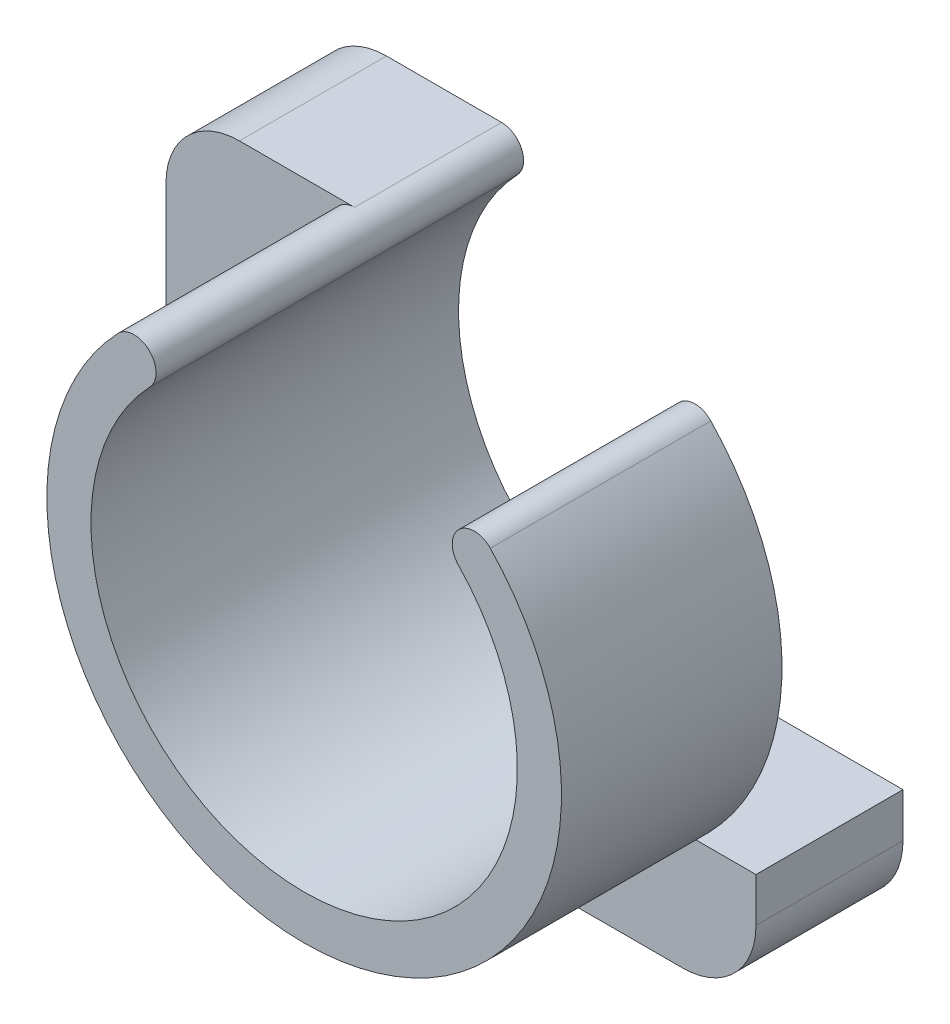
from build123d import *

# Parameters (mm, degrees)
BOSS_EXTRUDE1_START = 10
BOSS_EXTRUDE1_DEPTH = 15
BOSS_EXTRUDE3_DEPTH = 10
FILLET1_R           = 5
BOSS_EXTRUDE4_START = 10
BOSS_EXTRUDE4_DEPTH = 10


with BuildPart() as part:
    # Sketch1 → Boss-Extrude1 (new body)
    with BuildSketch(Plane.XY.offset(BOSS_EXTRUDE1_START)):
        with BuildLine():
            ThreePointArc((8.488266962, -3.382949128), (-2.000000007, -27.895254363), (-12.488266953, -3.382949118))
            ThreePointArc((-12.488266953, -3.382949118), (-12.537504406, -1.262200246), (-14.658253277, -1.311437749))
            ThreePointArc((-14.658253277, -1.311437749), (-1.999999957, -30.895254363), (10.658253217, -1.311437686))
            ThreePointArc((10.658253217, -1.311437686), (8.53750437, -1.262200281), (8.488266962, -3.382949128))
        make_face()
    extrude(amount=BOSS_EXTRUDE1_DEPTH)

    # Sketch2 → Boss-Extrude3 (add)
    with BuildSketch(Plane.XY):
        with BuildLine():
            ThreePointArc((-12.488266958, -3.382949123), (-12.194196355, -1.757122894), (-13.573260086, -0.847193408))
            ThreePointArc((-13.573260086, -0.847193408), (-14.163330605, -0.968129672), (-14.658253225, -1.311437694))
            ThreePointArc((-14.658253225, -1.311437694), (-19.372506678, -15.503811146), (-11.4, -28.156351884))
            Line((-11.4, -28.156351884), (-11.4, -26.495254363))
            Line((-11.4, -26.495254363), (-11.4, -24.435634792))
            ThreePointArc((-11.4, -24.435634792), (-16.480665872, -14.143796874), (-12.488266958, -3.382949123))
        make_face()
        with BuildLine():
            ThreePointArc((-14.658253225, -1.311437694), (-14.163330605, -0.968129672), (-13.573260086, -0.847193408))
            Line((-13.573260086, -0.847193408), (-26.4, -0.847193408))
            Line((-26.4, -0.847193408), (-26.4, -34.495254363))
            Line((-26.4, -34.495254363), (-11.4, -34.495254363))
            Line((-11.4, -34.495254363), (-11.4, -28.156351884))
            ThreePointArc((-11.4, -28.156351884), (-19.372506678, -15.503811146), (-14.658253225, -1.311437694))
        make_face()
        with BuildLine():
            ThreePointArc((9.603447763, -26.495254363), (-0.620287438, -30.840780817), (-11.4, -28.156351884))
            Line((-11.4, -28.156351884), (-11.4, -34.495254363))
            Line((-11.4, -34.495254363), (13.729379502, -34.495254363))
            Line((13.729379502, -34.495254363), (13.729379502, -26.495254363))
            Line((13.729379502, -26.495254363), (9.603447763, -26.495254363))
        make_face()
        with BuildLine():
            Line((-8.216108107, -26.495254363), (-11.4, -26.495254363))
            Line((-11.4, -26.495254363), (-11.4, -28.156351884))
            ThreePointArc((-11.4, -28.156351884), (-0.620287438, -30.840780817), (9.603447763, -26.495254363))
            Line((9.603447763, -26.495254363), (4.216108107, -26.495254363))
            ThreePointArc((4.216108107, -26.495254363), (-2, -27.895254363), (-8.216108107, -26.495254363))
        make_face()
    extrude(amount=BOSS_EXTRUDE3_DEPTH)

    # Fillet1
    fillet1_edges = [part.edges().sort_by_distance(p)[0] for p in [
        (-26.4, -34.495254363, 5),
        (13.729379502, -34.495254363, 5),
        (-26.4, -0.847193408, 5),
    ]]
    fillet(fillet1_edges, radius=FILLET1_R)

    # Sketch4 → Boss-Extrude4 (add)
    with BuildSketch(Plane(origin=(0, 0, 10), x_dir=(-1, 0, 0), z_dir=(0, 0, -1)).offset(BOSS_EXTRUDE4_START)):
        with BuildLine():
            Line((8.216108107, -26.495254363), (11.4, -26.495254363))
            Line((11.4, -26.495254363), (11.4, -24.435634792))
            ThreePointArc((11.4, -24.435634792), (9.875672435, -25.569973403), (8.216108107, -26.495254363))
        make_face()
    extrude(amount=-BOSS_EXTRUDE4_DEPTH)


solid = part.part
